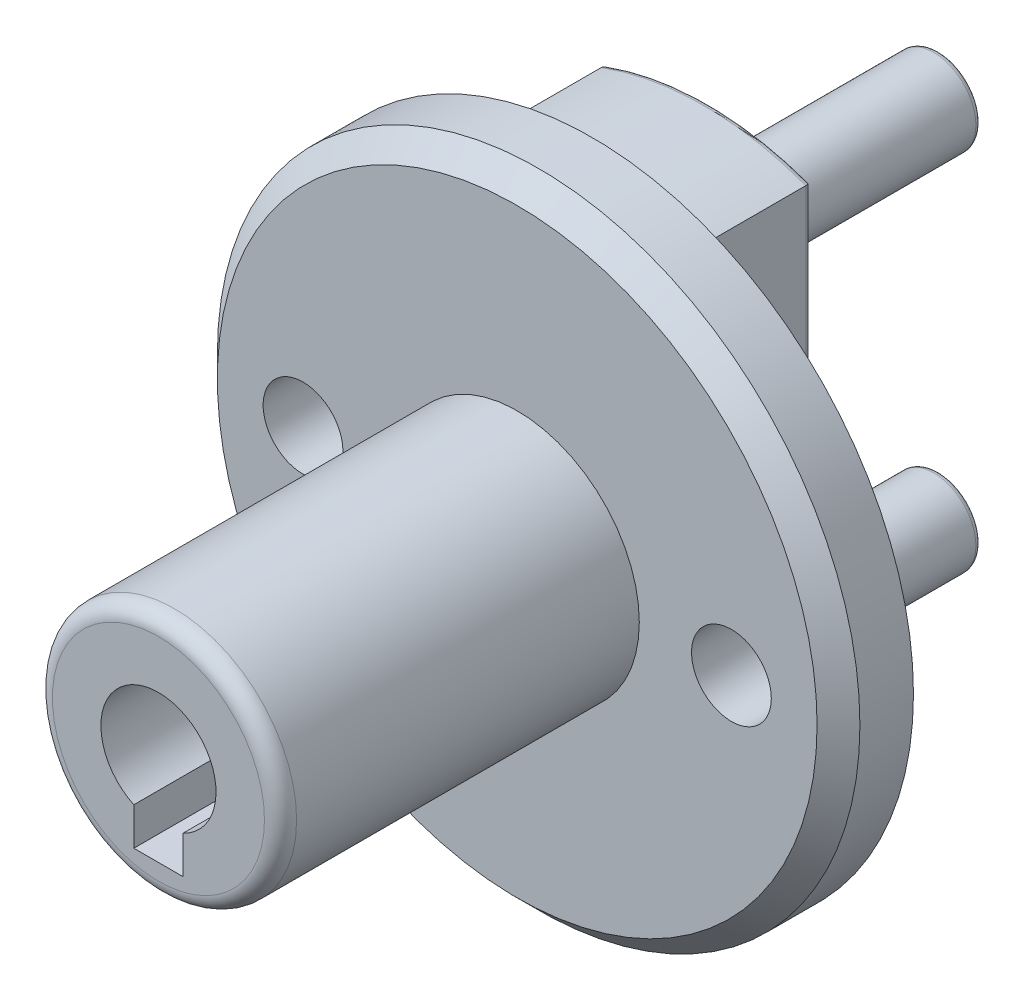
from build123d import *

# Parameters (mm, degrees)
SKETCH2_R           = 30
BOSS_EXTRUDE1_DEPTH = 7
SKETCH3_R           = 11.4
BOSS_EXTRUDE2_DEPTH = 33.5
BOSS_EXTRUDE3_DEPTH = 10.9
SKETCH5_R           = 6.5
BOSS_EXTRUDE4_DEPTH = 3
SKETCH6_R           = 3.9250000000000007
BOSS_EXTRUDE5_DEPTH = 21.5
SKETCH7_R           = 3.7250000000000045
CUT_EXTRUDE1_DEPTH  = 58.89956821946084
CUT_EXTRUDE2_DEPTH  = 16.5
CHAMFER1_SIZE       = 2
FILLET1_R           = 1.5
FILLET2_R           = 0.5


with BuildPart() as part:
    # Sketch2 → Boss-Extrude1 (new body)
    with BuildSketch(Plane.XY):
        Circle(SKETCH2_R)
    extrude(amount=BOSS_EXTRUDE1_DEPTH)

    # Sketch3 → Boss-Extrude2 (add)
    with BuildSketch(Plane.XY.offset(7)):
        Circle(SKETCH3_R)
    extrude(amount=BOSS_EXTRUDE2_DEPTH)

    # Sketch4 → Boss-Extrude3 (add)
    with BuildSketch(Plane(origin=(0, 0, 0), x_dir=(-1, 0, 0), z_dir=(0, 0, -1))):
        with BuildLine():
            Line((-9.55, -6.31664467894101), (-9.55, 6.316644678940989))
            ThreePointArc((-9.550000000000278, 6.3166446789410635), (-11.449999999999994, -9.01e-15), (-9.55000000000028, -6.316644678941083))
        make_face()
        with BuildLine():
            ThreePointArc((11.450000000000008, -1.041e-14), (10.964716138596623, 3.2981055168079236), (9.550000000000196, 6.316644678941209))
            Line((9.55, 6.316644678941156), (9.55, -6.316644678941177))
            ThreePointArc((9.550000000000196, -6.3166446789412305), (10.964716138596623, -3.2981055168079454), (11.450000000000008, -1.321e-14))
        make_face()
        with BuildLine():
            ThreePointArc((9.550000000000196, 6.316644678941209), (-8.134e-14, 11.44999999999999), (-9.550000000000278, 6.3166446789410635))
            Line((-9.55, 6.316644678940989), (-9.55, -6.31664467894101))
            ThreePointArc((-9.55000000000028, -6.316644678941083), (-7.652e-14, -11.450000000000012), (9.550000000000196, -6.3166446789412305))
            Line((9.55, -6.316644678941177), (9.55, 6.316644678941156))
        make_face()
        with BuildLine():
            Line((-9.55, -6.31664467894101), (-9.55, -25.681851568763488))
            Line((-9.55, -25.681851568763484), (9.55, -25.681851568763484))
            Line((9.55, -25.681851568763488), (9.55, -6.316644678941177))
            ThreePointArc((9.550000000000196, -6.3166446789412305), (-7.652e-14, -11.450000000000012), (-9.55000000000028, -6.316644678941083))
        make_face()
        with BuildLine():
            Line((9.55, 25.68185156876348), (-9.55, 25.68185156876348))
            Line((-9.55, 25.68185156876348), (-9.55, 6.316644678940989))
            ThreePointArc((-9.550000000000278, 6.3166446789410635), (-8.134e-14, 11.44999999999999), (9.550000000000196, 6.316644678941209))
            Line((9.55, 6.316644678941156), (9.55, 25.68185156876348))
        make_face()
        with BuildLine():
            ThreePointArc((9.55, 25.681851568763488), (-3.55e-15, 27.399999999999988), (-9.55, 25.68185156876348))
            Line((-9.55, 25.68185156876348), (9.55, 25.68185156876348))
        make_face()
        with BuildLine():
            Line((9.55, -25.681851568763484), (-9.55, -25.681851568763484))
            ThreePointArc((-9.55, -25.681851568763502), (1.91e-15, -27.40000000000001), (9.550000000000006, -25.681851568763506))
        make_face()
    extrude(amount=BOSS_EXTRUDE3_DEPTH)

    # Sketch5 → Boss-Extrude4 (add)
    with BuildSketch(Plane(origin=(0, 0, -10.9), x_dir=(-1, 0, 0), z_dir=(0, 0, -1))):
        Circle(SKETCH5_R)
    extrude(amount=BOSS_EXTRUDE4_DEPTH)

    # Sketch6 → Boss-Extrude5 (add)
    with BuildSketch(Plane(origin=(0, 0, -10.9), x_dir=(-1, 0, 0), z_dir=(0, 0, -1))):
        with Locations((4.71e-15, -17)):
            Circle(SKETCH6_R)
        with Locations((-5.7e-15, 17)):
            Circle(SKETCH6_R)
    extrude(amount=BOSS_EXTRUDE5_DEPTH)

    # Sketch7 → Cut-Extrude1 (cut, through all)
    with BuildSketch(Plane.XY.offset(7)):
        with Locations((20, 6.68e-15)):
            Circle(SKETCH7_R)
        with Locations((-20, -5.57e-15)):
            Circle(SKETCH7_R)
    extrude(amount=-CUT_EXTRUDE1_DEPTH, mode=Mode.SUBTRACT)

    # Sketch8 → Cut-Extrude2 (cut)
    with BuildSketch(Plane.XY.offset(40.5)):
        with BuildLine():
            Line((-2.3, -4.858047447277736), (-2.3000000000000003, -2.3749999999999987))
            Line((-2.3000000000000003, -2.3749999999999987), (2.2999999999999985, -2.3749999999999987))
            Line((2.2999999999999985, -2.3749999999999987), (2.2999999999999994, -4.858047447277605))
            ThreePointArc((2.2999999999999394, -4.8580474472775865), (4.541647553476583, -2.8747282480262664), (5.375, -1.32e-15))
            ThreePointArc((5.375, 0), (-2.874728248026342, 4.541647553476536), (-2.2999999999997773, -4.858047447277664))
        make_face()
        with BuildLine():
            Line((2.2999999999999985, -2.3749999999999987), (-2.3000000000000003, -2.3749999999999987))
            Line((-2.3000000000000003, -2.3749999999999987), (-2.3, -4.858047447277736))
            ThreePointArc((-2.2999999999997773, -4.858047447277664), (8.972e-14, -5.375), (2.2999999999999394, -4.8580474472775865))
            Line((2.2999999999999994, -4.858047447277605), (2.2999999999999985, -2.3749999999999987))
        make_face()
        with BuildLine():
            ThreePointArc((2.2999999999999394, -4.8580474472775865), (8.972e-14, -5.375), (-2.2999999999997773, -4.858047447277664))
            Line((-2.3, -4.858047447277736), (-2.2999999999999994, -8.375))
            Line((-2.2999999999999994, -8.375), (2.3000000000000003, -8.375))
            Line((2.3000000000000003, -8.375), (2.2999999999999994, -4.858047447277605))
        make_face()
    extrude(amount=-CUT_EXTRUDE2_DEPTH, mode=Mode.SUBTRACT)

    # Chamfer1
    chamfer1_edges = [part.edges().sort_by_distance(p)[0] for p in [
        (-30, 1.7e-14, 7),
    ]]
    chamfer(chamfer1_edges, length=CHAMFER1_SIZE)

    # Fillet1
    fillet1_edges = [part.edges().sort_by_distance(p)[0] for p in [
        (-11.4, 1.4e-15, 40.5),
    ]]
    fillet(fillet1_edges, radius=FILLET1_R)

    # Fillet2
    fillet2_edges = [part.edges().sort_by_distance(p)[0] for p in [
        (11.449999999999996, 7.372e-14, 0),
        (9.55, -15.999248123852249, 0),
        (-4e-15, -27.400000000000002, 0),
        (-9.55, -15.999248123852333, -10.9),
        (-11.45000000000001, -8.88e-15, 0),
        (-9.55, 15.999248123852318, -10.9),
        (-2.22e-15, 27.399999999999984, 0),
        (9.55, 15.999248123852235, 0),
        (11.449999999999985, -9.88e-15, -10.9),
        (9.55, -15.999248123852249, -10.9),
        (-4e-15, -27.400000000000002, -10.9),
        (-11.45000000000001, -8.626e-14, -10.9),
        (-2.22e-15, 27.399999999999984, -10.9),
        (9.55, 15.999248123852235, -10.9),
        (-9.55, 15.999248123852318, 0),
        (-9.55, -15.999248123852333, 0),
        (6.5, -2.09e-15, -10.9),
        (6.5, -2.09e-15, -13.9),
        (3.924999999999996, -17, -10.9),
        (3.924999999999996, -17, -32.4),
        (3.9250000000000065, 17, -10.9),
        (3.9250000000000065, 17, -32.4),
    ]]
    fillet(fillet2_edges, radius=FILLET2_R)


solid = part.part
